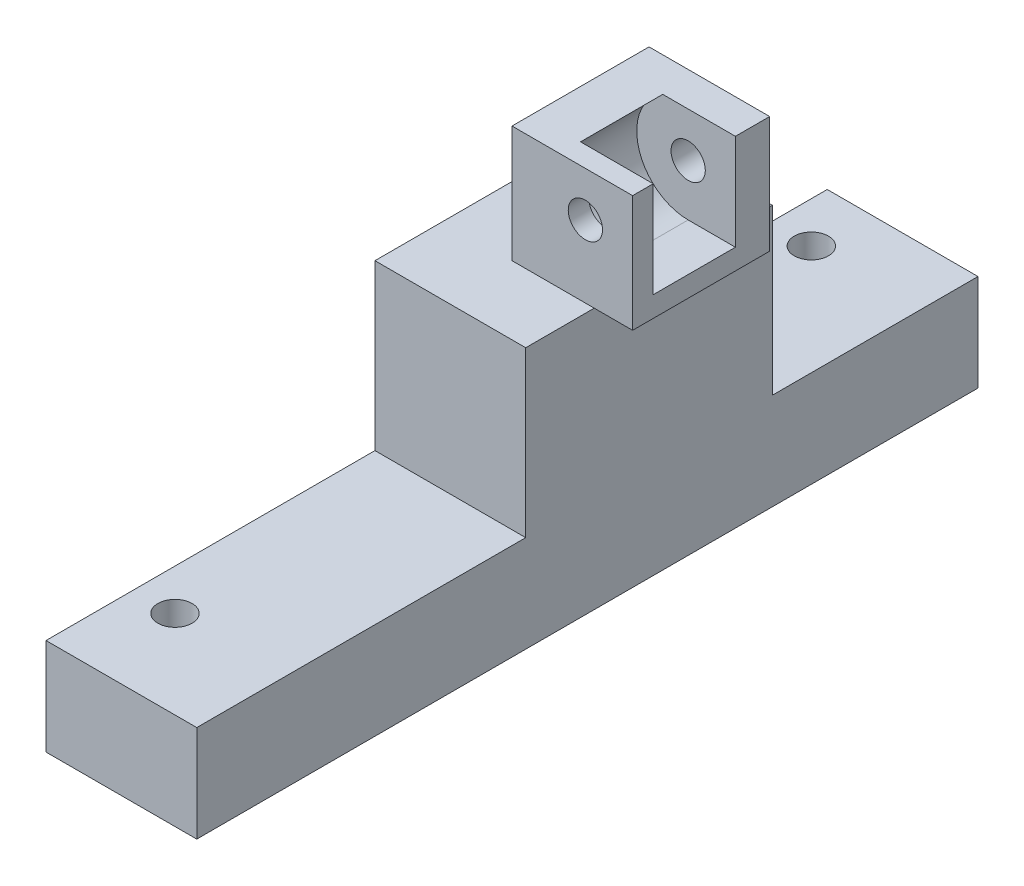
from build123d import *

# Parameters (mm, degrees)
BOSS_EXTRUDE1_DEPTH = 21.59
SKETCH2_W           = 22.352
SKETCH2_H           = 21.6154
SKETCH2_R           = 3.175
BOSS_EXTRUDE2_DEPTH = 3.81
SKETCH3_R           = 3.175
BOSS_EXTRUDE3_DEPTH = 6.35
SKETCH4_W           = 27.94
SKETCH4_H           = 144.78
BOSS_EXTRUDE4_DEPTH = 48.388036719
SKETCH5_W           = 38.1
SKETCH5_H           = 30.48
SKETCH5_W_2         = 60.96
CUT_EXTRUDE1_DEPTH  = 385.104870976
SKETCH6_R           = 3.175
CUT_EXTRUDE2_DEPTH  = 833.884500924


with BuildPart() as part:
    # Sketch1 → Boss-Extrude1 (new body)
    with BuildSketch(Plane.XY):
        with BuildLine():
            Line((-792.583825879, 352.959436719), (-792.583825879, 356.769436719))
            Line((-792.583825879, 356.769436719), (-801.338321143, 356.769436719))
            ThreePointArc((-801.338321143, 356.769436719), (-803.772947911, 357.085841957), (-806.045825879, 358.014036719))
            ThreePointArc((-806.045825879, 358.014036719), (-810.863321143, 366.294436719), (-806.045825879, 374.574836719))
            Line((-806.045825879, 374.574836719), (-814.935825879, 374.574836719))
            Line((-814.935825879, 374.574836719), (-814.935825879, 352.959436719))
            Line((-814.935825879, 352.959436719), (-792.583825879, 352.959436719))
        make_face()
    extrude(amount=-BOSS_EXTRUDE1_DEPTH)

    # Sketch2 → Boss-Extrude2 (add)
    with BuildSketch(Plane.XY):
        with Locations((-803.759825879, 363.767136719)):
            Rectangle(SKETCH2_W, SKETCH2_H)
        with Locations(Location((-801.338321143, 366.294436719, 0), (0, 0, 180))):
            Circle(SKETCH2_R, mode=Mode.SUBTRACT)
    extrude(amount=BOSS_EXTRUDE2_DEPTH)

    # Sketch3 → Boss-Extrude3 (add)
    with BuildSketch(Plane(origin=(0, 0, -21.59), x_dir=(-1, 0, 0), z_dir=(0, 0, -1))):
        with BuildLine():
            Line((792.583825879, 356.769436719), (792.583825879, 374.574836719))
            Line((792.583825879, 374.574836719), (806.045825879, 374.574836719))
            ThreePointArc((806.045825879, 374.574836719), (810.546915906, 363.859809951), (801.338321143, 356.769436719))
            Line((801.338321143, 356.769436719), (792.583825879, 356.769436719))
        make_face()
        with Locations((801.338321143, 366.294436719)):
            Circle(SKETCH3_R, mode=Mode.SUBTRACT)
    extrude(amount=-BOSS_EXTRUDE3_DEPTH)

    # Sketch4 → Boss-Extrude4 (add)
    with BuildSketch(Plane.XZ.offset(-352.959436719)):
        with Locations((-813.665825879, 5.08)):
            Rectangle(SKETCH4_W, SKETCH4_H)
    extrude(amount=BOSS_EXTRUDE4_DEPTH)

    # Sketch5 → Cut-Extrude1 (cut, through all)
    with BuildSketch(Plane.ZY.offset(827.635825879)):
        with Locations((-48.26, 337.719436719)):
            Rectangle(SKETCH5_W, SKETCH5_H)
        with Locations((46.99, 337.719436719)):
            Rectangle(SKETCH5_W_2, SKETCH5_H)
    extrude(amount=-CUT_EXTRUDE1_DEPTH, mode=Mode.SUBTRACT)

    # Sketch6 → Cut-Extrude2 (cut, through all)
    with BuildSketch(Plane(origin=(0, 322.479436719, 0), x_dir=(1, 0, 0), z_dir=(0, 1, 0))):
        with Locations(Location((-820.039, 56.765714286, 0), (0, 0, 270))):
            Circle(SKETCH6_R)
        with Locations(Location((-820.039, -61.162857143, 0), (0, 0, 270))):
            Circle(SKETCH6_R)
    extrude(amount=-CUT_EXTRUDE2_DEPTH, mode=Mode.SUBTRACT)


solid = part.part
